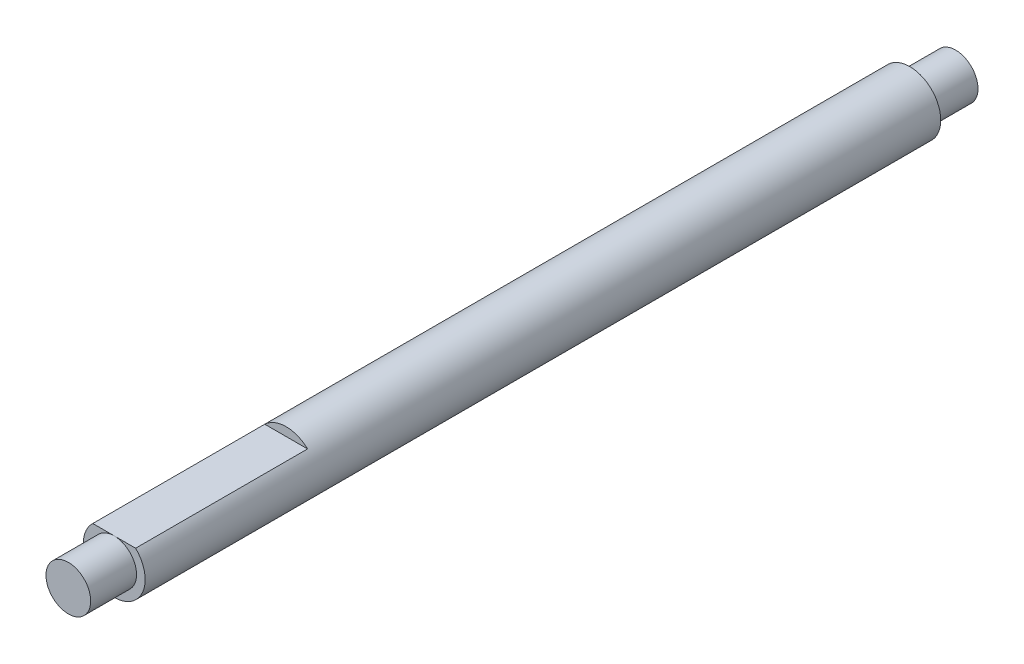
from build123d import *

# Parameters (mm, degrees)
ESBO_O1_R                = 2.7
RESSALTO_EXTRUS_O1_DEPTH = 69.4
ESBO_O2_R                = 1.95
RESSALTO_EXTRUS_O2_DEPTH = 4
RESSALTO_EXTRUS_O3_START = 4
ESBO_O3_R                = 1.95
RESSALTO_EXTRUS_O3_DEPTH = 4
ESBO_O5_W                = 3.73496988
ESBO_O5_H                = 0.75
CORTE_EXTRUS_O2_DEPTH    = 15


with BuildPart() as part:
    # Esboço1 → Ressalto-extrusão1 (new body)
    with BuildSketch(Plane.XY):
        Circle(ESBO_O1_R)
    extrude(amount=RESSALTO_EXTRUS_O1_DEPTH)

    # Esboço2 → Ressalto-extrusão2 (add)
    with BuildSketch(Plane.XY.offset(69.4)):
        Circle(ESBO_O2_R)
    extrude(amount=RESSALTO_EXTRUS_O2_DEPTH)

    # Esboço3 → Ressalto-extrusão3 (add)
    with BuildSketch(Plane(origin=(0, 0, 0), x_dir=(-1, 0, 0), z_dir=(0, 0, -1)).offset(RESSALTO_EXTRUS_O3_START)):
        with Locations(Location((0, 0, 0), (0, 0, 180))):
            Circle(ESBO_O3_R)
    extrude(amount=-RESSALTO_EXTRUS_O3_DEPTH)

    # Esboço5 → Corte-extrusão2 (cut)
    with BuildSketch(Plane.XY.offset(69.4)):
        with Locations((0, 2.325)):
            Rectangle(ESBO_O5_W, ESBO_O5_H)
    extrude(amount=-CORTE_EXTRUS_O2_DEPTH, mode=Mode.SUBTRACT)


solid = part.part
